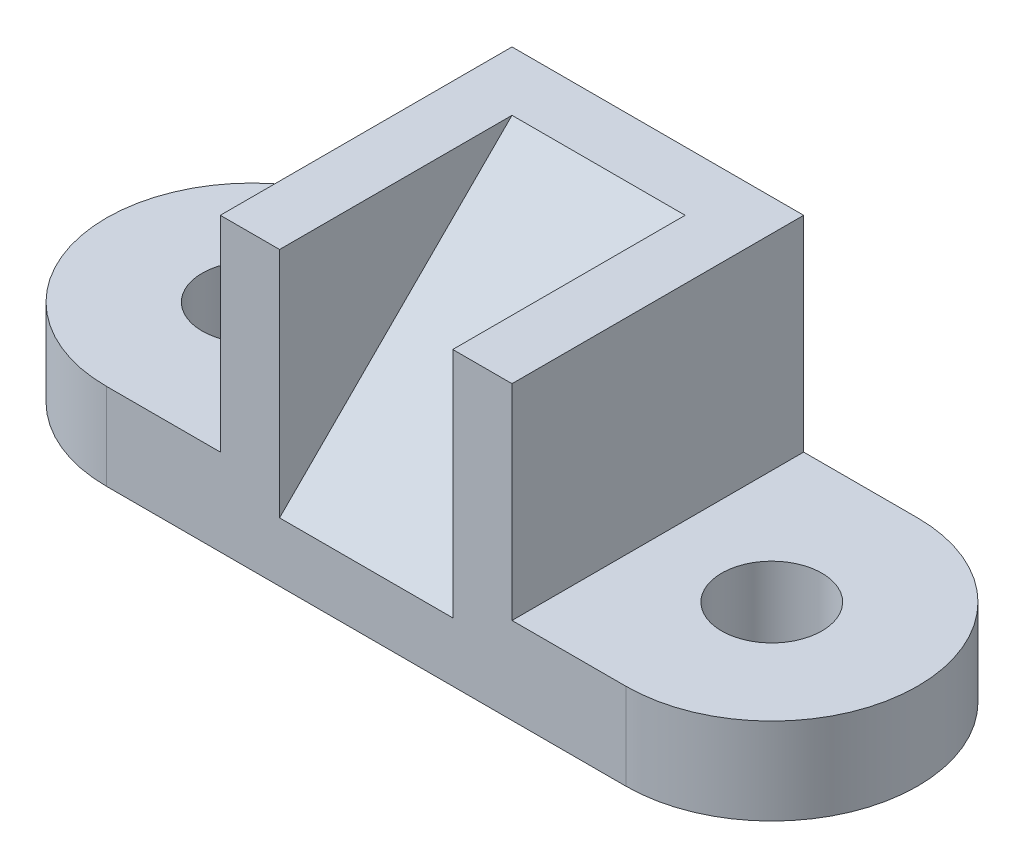
from build123d import *

# Parameters (mm, degrees)
SKETCH1_R           = 11
BOSS_EXTRUDE1_DEPTH = 19
SKETCH2_W           = 32
SKETCH2_H           = 64
BOSS_EXTRUDE2_DEPTH = 45
CUT_EXTRUDE2_DEPTH  = 19


with BuildPart() as part:
    # Sketch1 → Boss-Extrude1 (new body)
    with BuildSketch(Plane(origin=(0, 0, 0), x_dir=(1, 0, 0), z_dir=(0, 1, 0))):
        with BuildLine():
            Line((0, 0), (-57, 0))
            ThreePointArc((-57, 0), (-89, 32), (-57, 64))
            Line((-57, 64), (0, 64))
            Line((0, 64), (0, 0))
        make_face()
        with Locations(Location((-57, 32, 0), (0, 0, 270))):
            Circle(SKETCH1_R, mode=Mode.SUBTRACT)
    boss_extrude1 = extrude(amount=BOSS_EXTRUDE1_DEPTH)

    # Sketch2 → Boss-Extrude2 (add)
    with BuildSketch(Plane(origin=(0, 19, 0), x_dir=(1, 0, 0), z_dir=(0, 1, 0))):
        with Locations((-16, 32)):
            Rectangle(SKETCH2_W, SKETCH2_H)
    boss_extrude2 = extrude(amount=BOSS_EXTRUDE2_DEPTH)

    # Sketch3 → Cut-Extrude2 (cut)
    with BuildSketch(Plane(origin=(0, 0, 0), x_dir=(0, 0, -1), z_dir=(1, 0, 0))):
        Polygon((0, 13), (51, 64), (0, 64), align=None)
    cut_extrude2 = extrude(amount=-CUT_EXTRUDE2_DEPTH, mode=Mode.SUBTRACT)

    # Mirror1: Boss-Extrude1, Boss-Extrude2, Cut-Extrude2 across plane
    add(boss_extrude1.mirror(Plane(origin=(0, 0, 0), x_dir=(0, 0, 1), z_dir=(1, 0, 0))))
    add(boss_extrude2.mirror(Plane(origin=(0, 0, 0), x_dir=(0, 0, 1), z_dir=(1, 0, 0))))
    add(cut_extrude2.mirror(Plane(origin=(0, 0, 0), x_dir=(0, 0, 1), z_dir=(1, 0, 0))), mode=Mode.SUBTRACT)


solid = part.part
